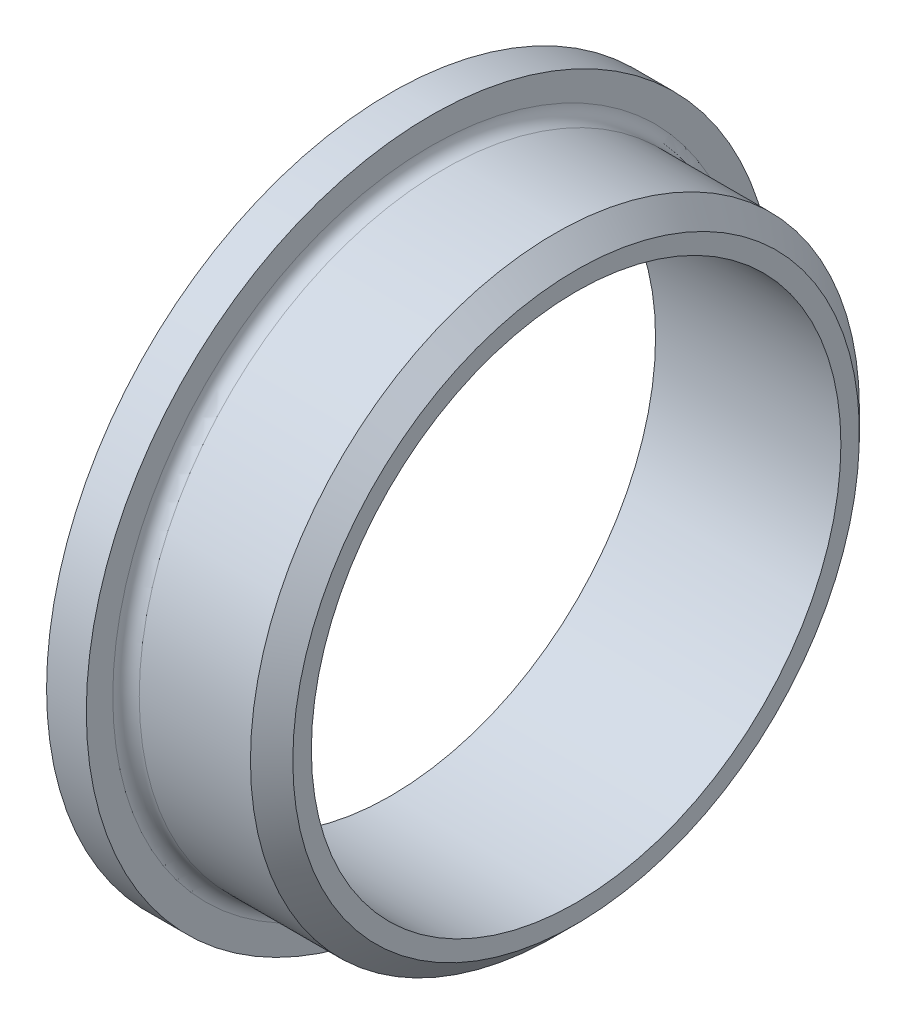
from build123d import *

# Parameters (mm, degrees)
FILLET1_R     = 0.5
CHAMFER1_SIZE = 0.8


with BuildPart() as part:
    # Sketch1 → Revolve1 (revolve)
    with BuildSketch(Plane.XY, mode=Mode.PRIVATE) as revolve1_sk:
        Polygon((7, 10), (0, 10), (0, 13), (1.5, 13), (1.5, 11.5), (7, 11.5), align=None)
    revolve(revolve1_sk.sketch.rotate(Axis((0, 0, 0), (1, 0, 0)), 90), axis=Axis((0, 0, 0), (1, 0, 0)))

    # Fillet1
    fillet1_edges = [part.edges().sort_by_distance(p)[0] for p in [
        (1.5, 0, -11.5),
    ]]
    fillet(fillet1_edges, radius=FILLET1_R)

    # Chamfer1
    chamfer1_edges = [part.edges().sort_by_distance(p)[0] for p in [
        (7, 0, -11.5),
    ]]
    chamfer(chamfer1_edges, length=CHAMFER1_SIZE)


solid = part.part
